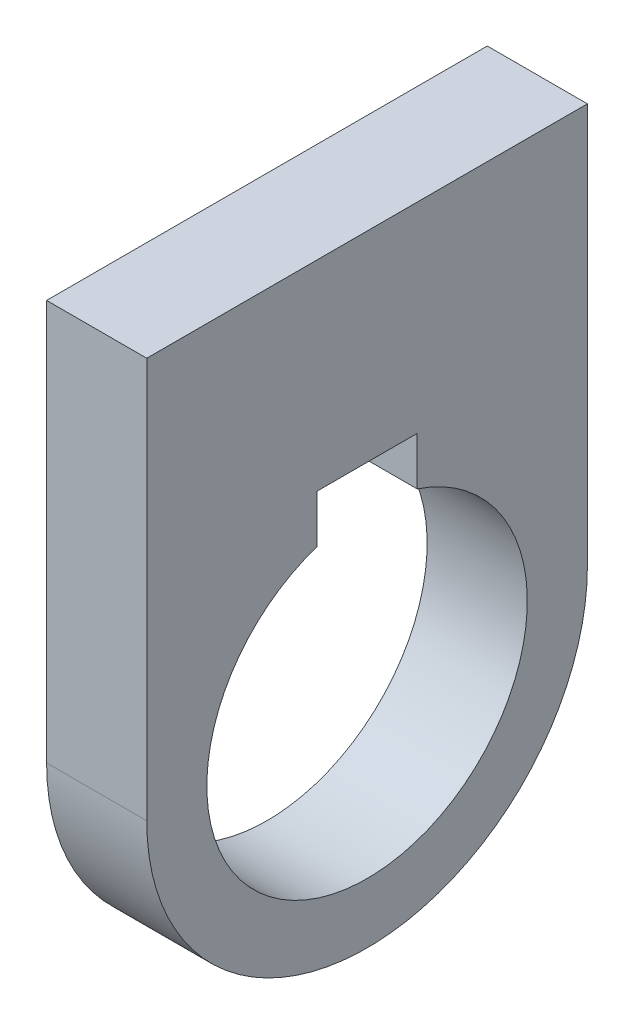
from build123d import *

# Parameters (mm, degrees)
BOSS_EXTRUDE1_DEPTH = 5


with BuildPart() as part:
    # Sketch1 → Boss-Extrude1 (new body)
    with BuildSketch(Plane(origin=(0, 0, 0), x_dir=(0, 0, -1), z_dir=(1, 0, 0))):
        with BuildLine():
            Line((-11, 0), (-11, 20))
            Line((-11, 20), (11, 20))
            Line((11, 20), (11, 0))
            ThreePointArc((11, 0), (0, -11), (-11, 0))
        make_face()
        with BuildLine():
            Line((-2.5, 10), (2.5, 10))
            Line((2.5, 10), (2.5, 7.599342077))
            ThreePointArc((2.5, 7.599342077), (0, -8), (-2.5, 7.599342077))
            Line((-2.5, 7.599342077), (-2.5, 10))
        make_face(mode=Mode.SUBTRACT)
    extrude(amount=BOSS_EXTRUDE1_DEPTH)


solid = part.part
